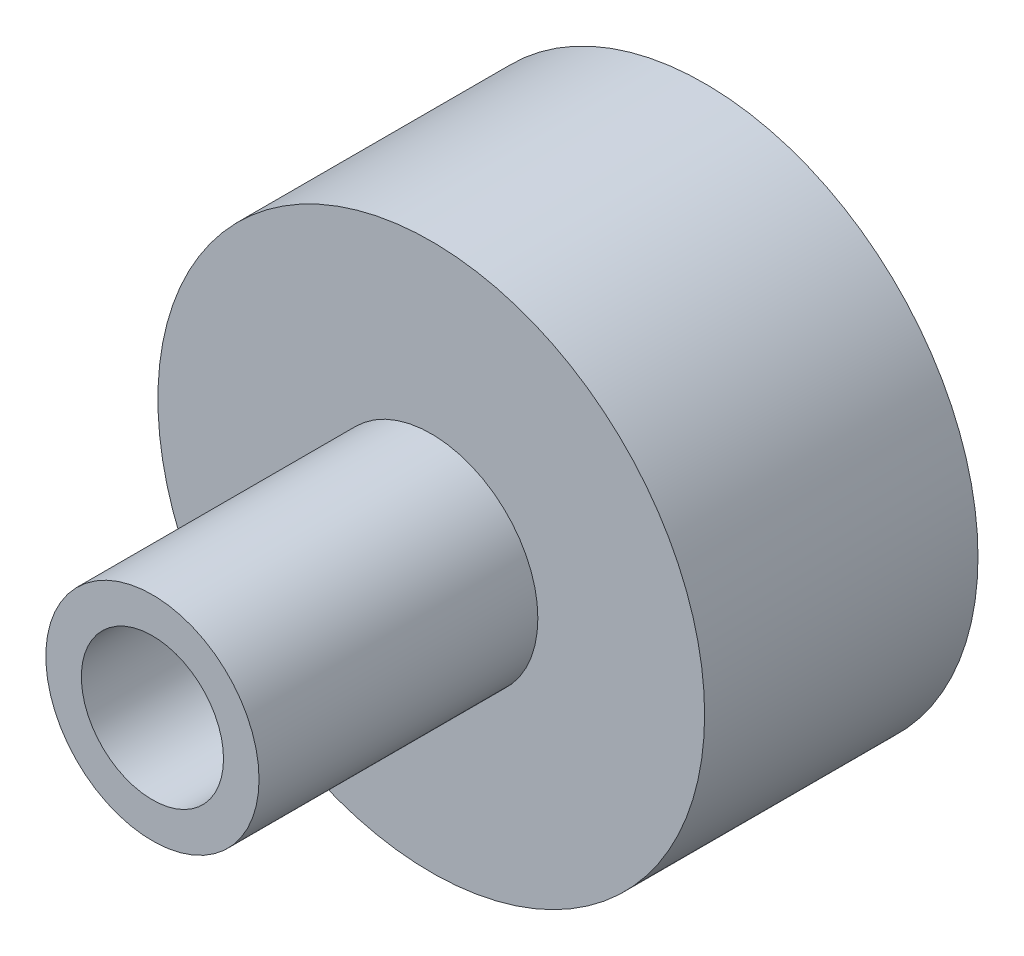
from build123d import *

# Parameters (mm, degrees)
SKETCH1_R      = 10
EXTRUDE1_DEPTH = 10
SKETCH2_R      = 3.9
EXTRUDE2_DEPTH = 10.2
EXTRUDE3_REACH = 26.658
SKETCH3_R      = 2.6


with BuildPart() as part:
    # Sketch1 → Extrude1 (new body)
    with BuildSketch(Plane.XY):
        Circle(SKETCH1_R)
    extrude(amount=EXTRUDE1_DEPTH)

    # Sketch2 → Extrude2 (add)
    with BuildSketch(Plane.XY.offset(10)):
        Circle(SKETCH2_R)
    extrude(amount=EXTRUDE2_DEPTH)

    # Sketch3 → Extrude3 (cut, up to next)
    with BuildSketch(Plane.XY.offset(20.2), mode=Mode.PRIVATE) as extrude3_sk1:
        Circle(SKETCH3_R)
    extrude3_tool1 = extrude(extrude3_sk1.sketch, amount=-EXTRUDE3_REACH, mode=Mode.PRIVATE) & part.part
    add(extrude3_tool1.solids().sort_by_distance((0, 0, 20.2))[0], mode=Mode.SUBTRACT)


solid = part.part
